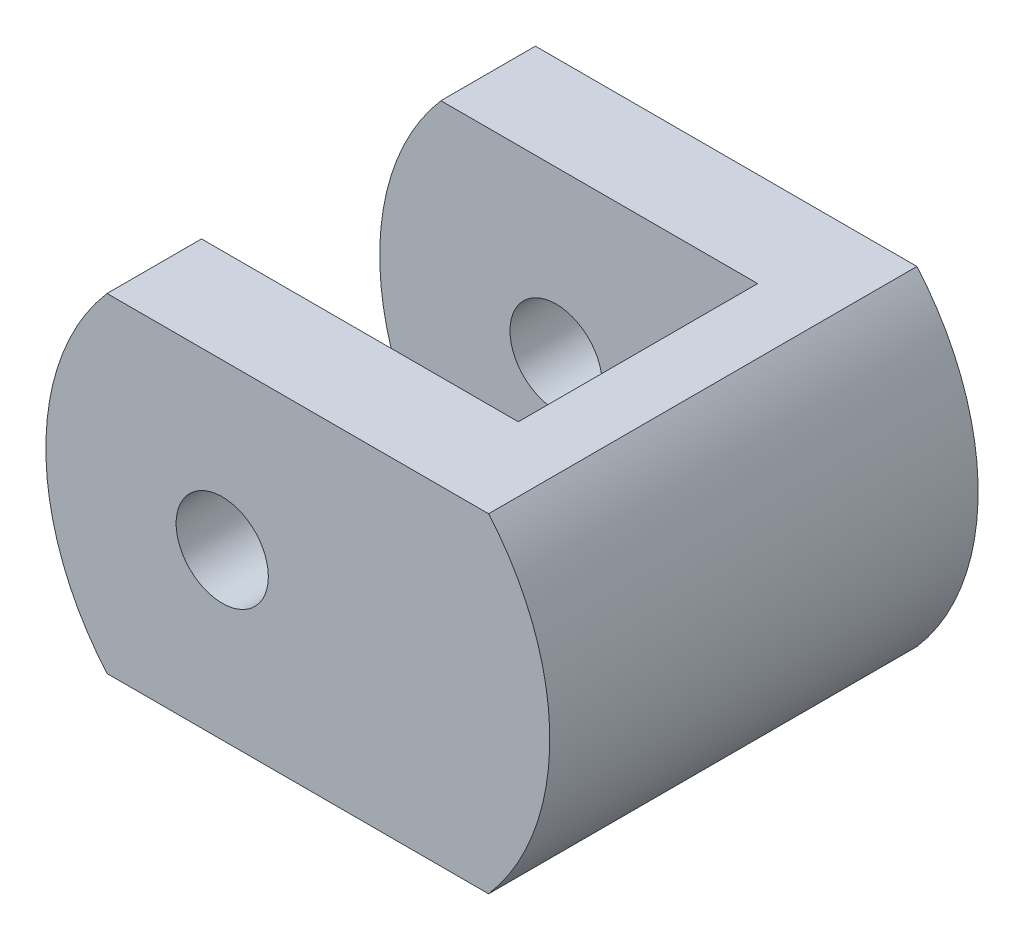
from build123d import *

# Parameters (mm, degrees)
SKETCH1_W               = 12.7
SKETCH1_H               = 21.59
CUT_EXTRUDE1_DEPTH      = 21.955
CUT_EXTRUDE1_DEPTH_BACK = 21.955
SKETCH3_W               = 19.05
SKETCH3_H               = 12.065
CUT_EXTRUDE2_DEPTH      = 21.955
CUT_EXTRUDE2_DEPTH_BACK = 21.955
SKETCH4_W               = 19.231618108
SKETCH4_H               = 5.318049176
CUT_EXTRUDE3_DEPTH      = 27.386441902
CUT_EXTRUDE3_DEPTH_BACK = 27.386441902
SKETCH5_R               = 2.3241


with BuildPart() as part:
    # Sketch1 → Revolve1 (revolve)
    with BuildSketch(Plane(origin=(0, 0, 0), x_dir=(1, 0, 0), z_dir=(0, 1, 0))):
        with Locations((6.35, 0)):
            Rectangle(SKETCH1_W, SKETCH1_H)
    revolve(axis=Axis((0, 0, 10.795), (0, 0, -1)))

    # Sketch3 → Cut-Extrude1 (cut, two sides: drawn at the far end of the back side and taken through both)
    with BuildSketch(Plane(origin=(0, 0, 0), x_dir=(1, 0, 0), z_dir=(0, 1, 0)).offset(-CUT_EXTRUDE1_DEPTH_BACK)):
        with Locations((-3.175, 0)):
            Rectangle(SKETCH3_W, SKETCH3_H)
    extrude(amount=CUT_EXTRUDE1_DEPTH + CUT_EXTRUDE1_DEPTH_BACK, mode=Mode.SUBTRACT)

    # Sketch4 → Cut-Extrude2 (cut, two sides: drawn at the far end of the back side and taken through both)
    with BuildSketch(Plane.XY.offset(-CUT_EXTRUDE2_DEPTH_BACK)):
        Polygon((-9.615809054, 8.296156715), (9.615809054, 8.296156715), (9.615809054, 14.116385036), (-9.615809054, 13.939663028), align=None)
        with Locations((0, -10.955181303)):
            Rectangle(SKETCH4_W, SKETCH4_H)
    extrude(amount=CUT_EXTRUDE2_DEPTH + CUT_EXTRUDE2_DEPTH_BACK, mode=Mode.SUBTRACT)

    # Sketch5 → Cut-Extrude3 (cut, two sides: drawn at the far end of the back side and taken through both)
    with BuildSketch(Plane.XY.offset(10.795).offset(-CUT_EXTRUDE3_DEPTH_BACK)):
        with Locations((-3.81, 0)):
            Circle(SKETCH5_R)
    extrude(amount=CUT_EXTRUDE3_DEPTH + CUT_EXTRUDE3_DEPTH_BACK, mode=Mode.SUBTRACT)


solid = part.part
